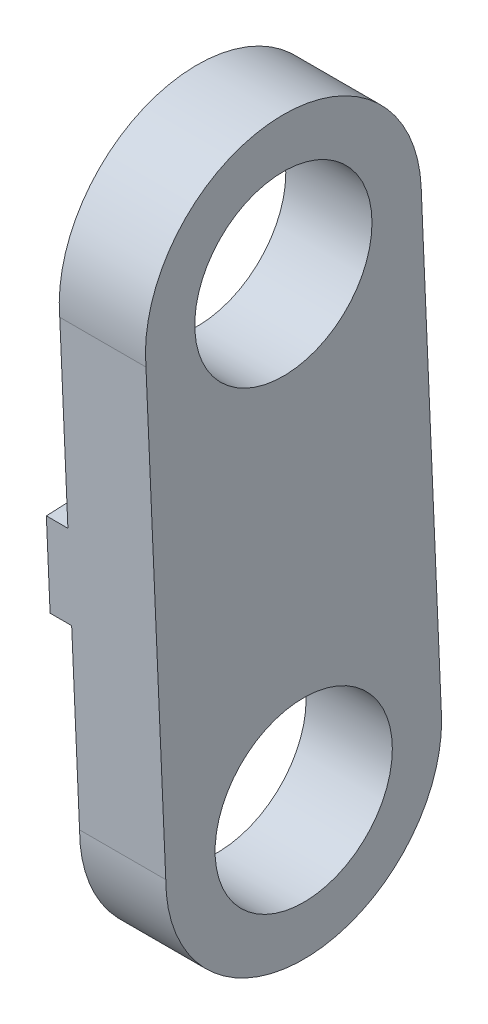
from build123d import *

# Parameters (mm, degrees)
SKETCH1_R           = 3.2639
BOSS_EXTRUDE1_DEPTH = 3.175
BOSS_EXTRUDE2_DEPTH = 0.79375


with BuildPart() as part:
    # Sketch1 → Boss-Extrude1 (new body)
    with BuildSketch(Plane(origin=(0, 0, 0), x_dir=(0, 0, -1), z_dir=(1, 0, 0))):
        with BuildLine():
            Line((191.040257253, 16.713856787), (191.77, 0))
            ThreePointArc((191.77, 0), (196.85, -5.08), (201.93, 0))
            Line((201.93, 0), (201.176152684, 17.376783675))
            ThreePointArc((201.176152684, 17.376783675), (195.769382968, 22.225777419), (191.040257253, 16.713856787))
        make_face()
        with Locations((196.85, 0)):
            Circle(SKETCH1_R, mode=Mode.SUBTRACT)
        with Locations((196.100926319, 17.15660796)):
            Circle(SKETCH1_R, mode=Mode.SUBTRACT)
    extrude(amount=BOSS_EXTRUDE1_DEPTH)

    # Sketch2 → Boss-Extrude2 (add)
    with BuildSketch(Plane.ZY):
        Polygon((-201.553076342, 8.688391837), (-201.621881253, 7.102383598), (-191.479241185, 6.659471722), (-191.340623275, 9.834343845), (-201.484271431, 10.274400077), align=None)
    extrude(amount=BOSS_EXTRUDE2_DEPTH)


solid = part.part
